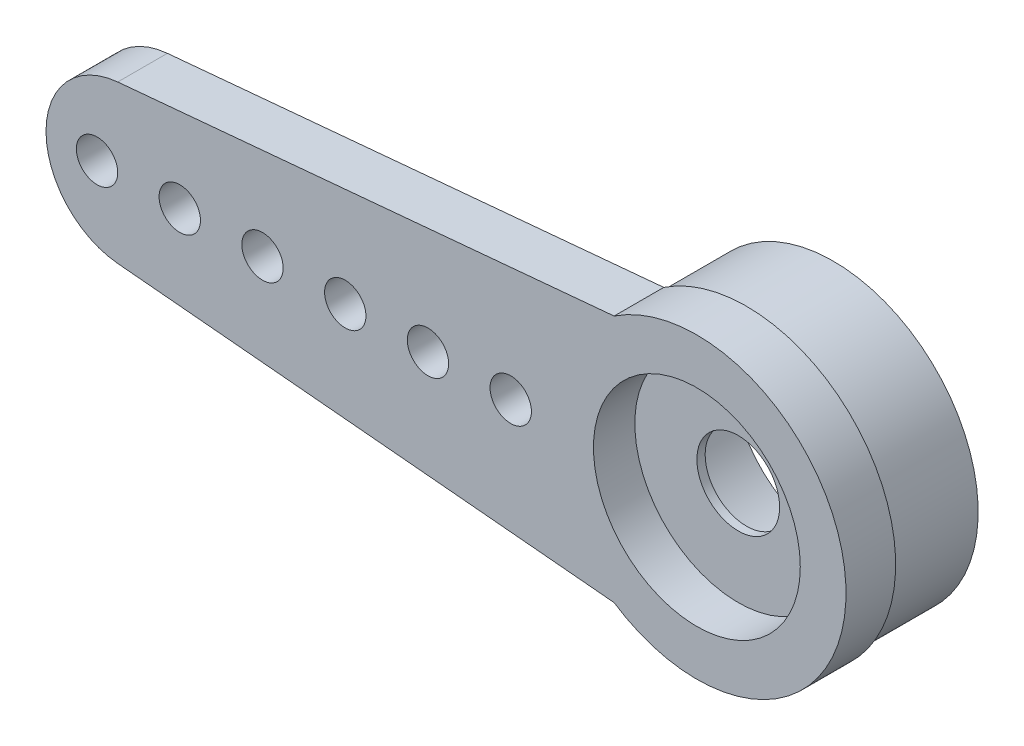
from build123d import *
from build123d.topology import SkipClean

# Parameters (mm, degrees)
BOSS_EXTRUDE1_DEPTH = 1.2
SKETCH2_R           = 3.5
BOSS_EXTRUDE2_DEPTH = 2.1
SKETCH3_R           = 2.5
CUT_EXTRUDE1_DEPTH  = 1
SKETCH4_R           = 1
CUT_EXTRUDE2_DEPTH  = 19.149516235
SKETCH6_R           = 2.45
CUT_EXTRUDE3_DEPTH  = 2.1
SKETCH8_R           = 0.5
CUT_EXTRUDE5_DEPTH  = 19.303140156
CUT_EXTRUDE6_DEPTH  = 10
CUT_EXTRUDE7_DEPTH  = 10


with BuildPart() as part:
    # Sketch1 → Boss-Extrude1 (new body)
    with BuildSketch(Plane.XY):
        with BuildLine():
            Line((-2, -6.75), (-2, -3))
            Line((-2, -3), (-14, -1.9))
            ThreePointArc((-14, -1.9), (-15.733799273, 0), (-14, 1.9))
            Line((-14, 1.9), (-2, 3))
            Line((-2, 3), (-2, 6.75))
            ThreePointArc((-2, 6.75), (0, 8.75), (2, 6.75))
            Line((2, 6.75), (2, 3))
            Line((2, 3), (14, 1.9))
            ThreePointArc((14, 1.9), (15.733799273, 0), (14, -1.9))
            Line((14, -1.9), (2, -3))
            Line((2, -3), (2, -6.75))
            ThreePointArc((2, -6.75), (0, -8.75), (-2, -6.75))
        make_face()
    extrude(amount=BOSS_EXTRUDE1_DEPTH)

    # Sketch2 → Boss-Extrude2 (add)
    with BuildSketch(Plane(origin=(0, 0, 0), x_dir=(-1, 0, 0), z_dir=(0, 0, -1))):
        Circle(SKETCH2_R)
    extrude(amount=BOSS_EXTRUDE2_DEPTH)

    # Sketch3 → Cut-Extrude1 (cut)
    with BuildSketch(Plane.XY.offset(1.2)):
        Circle(SKETCH3_R)
    extrude(amount=-CUT_EXTRUDE1_DEPTH, mode=Mode.SUBTRACT)

    # Sketch4 → Cut-Extrude2 (cut, through all)
    with BuildSketch(Plane.XY.offset(0.2)):
        Circle(SKETCH4_R)
    extrude(amount=-CUT_EXTRUDE2_DEPTH, mode=Mode.SUBTRACT)

    # Sketch6 → Cut-Extrude3 (cut)
    with BuildSketch(Plane(origin=(0, 0, -2.1), x_dir=(-1, 0, 0), z_dir=(0, 0, -1))):
        Circle(SKETCH6_R)
    extrude(amount=-CUT_EXTRUDE3_DEPTH, mode=Mode.SUBTRACT)

    # Sketch8 → Cut-Extrude5 (cut, through all)
    with BuildSketch(Plane.XY.offset(1.2)):
        with Locations((-4.5, 0)):
            Circle(SKETCH8_R)
        with Locations((-6.5, 0)):
            Circle(SKETCH8_R)
        with Locations((-8.5, 0)):
            Circle(SKETCH8_R)
        with Locations((-10.5, 0)):
            Circle(SKETCH8_R)
        with Locations((-12.5, 0)):
            Circle(SKETCH8_R)
        with Locations((-14.5, 0)):
            Circle(SKETCH8_R)
    extrude(amount=-CUT_EXTRUDE5_DEPTH, mode=Mode.SUBTRACT)

    # Sketch10 → Cut-Extrude6 (cut)
    with BuildSketch(Plane(origin=(0, 0, 0), x_dir=(-1, 0, 0), z_dir=(0, 0, -1))):
        with BuildLine():
            Line((-2, 3), (-3.5, 8.058048999))
            Line((-3.5, 8.058048999), (0.410688034, 10.263711762))
            Line((0.410688034, 10.263711762), (4.972399658, 6.328608878))
            Line((4.972399658, 6.328608878), (2, 3))
            ThreePointArc((2, 3), (0, 3.605551275), (-2, 3))
        make_face()
        with BuildLine():
            Line((-2, -3), (-3.79905406, -6.652770289))
            Line((-3.79905406, -6.652770289), (-0.630835306, -10.284036399))
            Line((-0.630835306, -10.284036399), (2.565835598, -9.787591171))
            Line((2.565835598, -9.787591171), (3.731558209, -4.826385145))
            Line((3.731558209, -4.826385145), (2, -3))
            ThreePointArc((2, -3), (0, -3.605551275), (-2, -3))
        make_face()
    extrude(amount=-CUT_EXTRUDE6_DEPTH, mode=Mode.SUBTRACT)

    # Sketch12 → Cut-Extrude7 (cut)
    with SkipClean():  # the faces are left unmerged after this step: merging them gives an invalid solid
        with BuildSketch(Plane(origin=(0, 0, 0), x_dir=(-1, 0, 0), z_dir=(0, 0, -1))):
            with BuildLine():
                Line((-14, 1.9), (-2, 3))
                ThreePointArc((-2, 3), (-3.605551275, 0), (-2, -3))
                Line((-2, -3), (-14, -1.9))
                ThreePointArc((-14, -1.9), (-15.733799273, 0), (-14, 1.9))
            make_face()
        extrude(amount=-CUT_EXTRUDE7_DEPTH, mode=Mode.SUBTRACT)


solid = part.part
